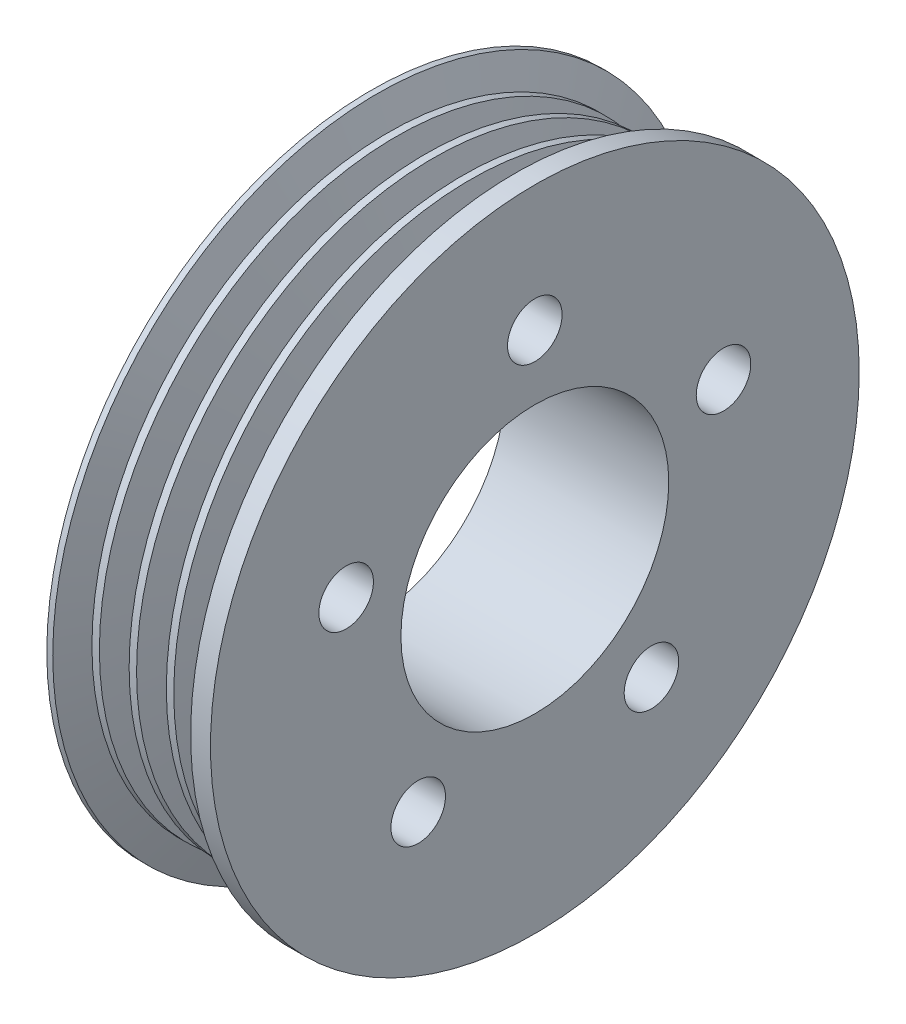
from build123d import *

# Parameters (mm, degrees)
ESCAREADO_PARA_PARAFUSO_COM_CABE_A_ESCAR_D           = 5.5
ESCAREADO_PARA_PARAFUSO_COM_CABE_A_ESCAR_CSINK_D     = 10.4
ESCAREADO_PARA_PARAFUSO_COM_CABE_A_ESCAR_CSINK_ANGLE = 90
PADR_OCIRCULAR1_COUNT                                = 5
ESBO_O5_R                                            = 32.7
ESBO_O5_R_2                                          = 13.5
ESBO_O5_R_3                                          = 2.75
RESSALTO_EXTRUS_O1_DEPTH                             = 2


with BuildPart() as part:
    # Esboço1 → Revolução1 (revolve)
    with BuildSketch(Plane.XY, mode=Mode.PRIVATE) as revolu_o1_sk:
        Polygon((0, 13.5), (16.5, 13.5), (16.5, 29.9), (13, 29.9), (11.9, 24.9), (11.1, 24.9), (10, 29.9), (9.25, 29.9), (8.15, 24.9), (7.35, 24.9), (6.25, 29.9), (5.5, 29.9), (4.4, 24.9), (3.6, 24.9), (2.5, 29.9), (0, 29.9), align=None)
    revolve(revolu_o1_sk.sketch.rotate(Axis((0, 0, 0), (1, 0, 0)), 90), axis=Axis((0, 0, 0), (1, 0, 0)))

    # Escareado para parafuso com cabeça escareada elevada de M51 (through all)
    with Locations(Plane.ZY):
        with Locations((0, 20)):
            escareado_para_parafuso_com_cabe_a_escar = CounterSinkHole(ESCAREADO_PARA_PARAFUSO_COM_CABE_A_ESCAR_D / 2, ESCAREADO_PARA_PARAFUSO_COM_CABE_A_ESCAR_CSINK_D / 2, counter_sink_angle=ESCAREADO_PARA_PARAFUSO_COM_CABE_A_ESCAR_CSINK_ANGLE)

    # PadrãoCircular1: Escareado para parafuso com cabeça escareada elevada de M51 ×5 about axis
    padr_ocircular1_axis = Axis((0, 0, 0), (1, 0, 0))
    for i in range(1, PADR_OCIRCULAR1_COUNT):
        add(escareado_para_parafuso_com_cabe_a_escar.rotate(padr_ocircular1_axis, i * 360 / PADR_OCIRCULAR1_COUNT), mode=Mode.SUBTRACT)

    # Esboço4 → Revolução2 (revolve)
    with BuildSketch(Plane.XY, mode=Mode.PRIVATE) as revolu_o2_sk:
        Polygon((0, 29.9), (0, 32.7), (0.6, 32.7), (1.75, 29.9), align=None)
    revolve(revolu_o2_sk.sketch.rotate(Axis((0, 0, 0), (1, 0, 0)), 90), axis=Axis((0, 0, 0), (1, 0, 0)))

    # Esboço5 → Ressalto-extrusão1 (add)
    with BuildSketch(Plane(origin=(16.5, 0, 0), x_dir=(0, 0, -1), z_dir=(1, 0, 0))):
        with Locations(Location((0, 0, 0), (0, 0, 180))):
            Circle(ESBO_O5_R)
        with Locations(Location((0, 0, 0), (0, 0, 180))):
            Circle(ESBO_O5_R_2, mode=Mode.SUBTRACT)
        with Locations(Location((-11.755705046, -16.180339887, 0), (0, 0, 180))):
            Circle(ESBO_O5_R_3, mode=Mode.SUBTRACT)
        with Locations(Location((11.755705046, -16.180339887, 0), (0, 0, 180))):
            Circle(ESBO_O5_R_3, mode=Mode.SUBTRACT)
        with Locations(Location((19.021130326, 6.180339887, 0), (0, 0, 180))):
            Circle(ESBO_O5_R_3, mode=Mode.SUBTRACT)
        with Locations(Location((0, 20, 0), (0, 0, 180))):
            Circle(ESBO_O5_R_3, mode=Mode.SUBTRACT)
        with Locations(Location((-19.021130326, 6.180339887, 0), (0, 0, 180))):
            Circle(ESBO_O5_R_3, mode=Mode.SUBTRACT)
    extrude(amount=-RESSALTO_EXTRUS_O1_DEPTH)


solid = part.part
